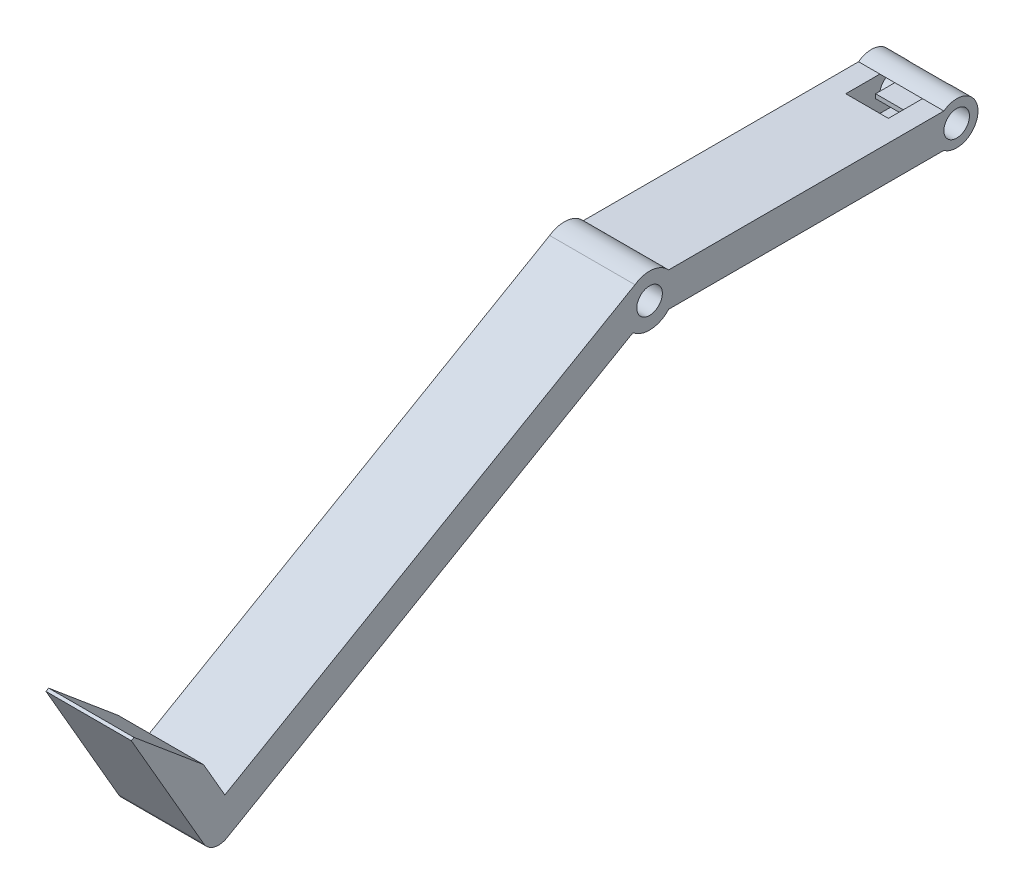
from build123d import *

# Parameters (mm, degrees)
SKETCH1_W           = 10
SKETCH1_H           = 36
BOSS_EXTRUDE2_DEPTH = 4
SKETCH5_R           = 3
BOSS_EXTRUDE3_DEPTH = 10
SKETCH6_R           = 2.5
BOSS_EXTRUDE4_DEPTH = 10
SKETCH9_R           = 1.5
CUT_EXTRUDE2_DEPTH  = 10
SKETCH10_W          = 5
SKETCH10_H          = 8
CUT_EXTRUDE3_DEPTH  = 4
SKETCH11_W          = 4
SKETCH11_H          = 0.5
BOSS_EXTRUDE6_DEPTH = 5
BOSS_EXTRUDE7_DEPTH = 10
SKETCH7_R           = 1.5
CUT_EXTRUDE4_DEPTH  = 10
SKETCH14_W          = 10
SKETCH14_H          = 4
BOSS_EXTRUDE8_DEPTH = 15
FILLET2_R           = 2
CHAMFER1_SIZE       = 10
CHAMFER1_SIZE2      = 3.639702343


with BuildPart() as part:
    # Sketch1 → Boss-Extrude2 (new body)
    with BuildSketch(Plane(origin=(0, 0, 0), x_dir=(1, 0, 0), z_dir=(0, 1, 0))):
        Rectangle(SKETCH1_W, SKETCH1_H)
    extrude(amount=BOSS_EXTRUDE2_DEPTH)

    # Sketch5 → Boss-Extrude3 (add)
    with BuildSketch(Plane(origin=(5, 0, 0), x_dir=(0, 0, -1), z_dir=(1, 0, 0))):
        with Locations((-18, 2)):
            Circle(SKETCH5_R)
    extrude(amount=-BOSS_EXTRUDE3_DEPTH)

    # Sketch6 → Boss-Extrude4 (add)
    with BuildSketch(Plane(origin=(5, 0, 0), x_dir=(0, 0, -1), z_dir=(1, 0, 0))):
        with Locations((18, 2)):
            Circle(SKETCH6_R)
    extrude(amount=-BOSS_EXTRUDE4_DEPTH)

    # Sketch9 → Cut-Extrude2 (cut)
    with BuildSketch(Plane(origin=(5, 0, 0), x_dir=(0, 0, -1), z_dir=(1, 0, 0))):
        with Locations((18, 2)):
            Circle(SKETCH9_R)
    extrude(amount=-CUT_EXTRUDE2_DEPTH, mode=Mode.SUBTRACT)

    # Sketch10 → Cut-Extrude3 (cut)
    with BuildSketch(Plane(origin=(0, 4, 0), x_dir=(1, 0, 0), z_dir=(0, 1, 0))):
        with Locations((0, 16.5)):
            Rectangle(SKETCH10_W, SKETCH10_H)
    extrude(amount=-CUT_EXTRUDE3_DEPTH, mode=Mode.SUBTRACT)

    # Sketch11 → Boss-Extrude6 (add)
    with BuildSketch(Plane.ZY.offset(-2.5)):
        with Locations((-18, 2)):
            Rectangle(SKETCH11_W, SKETCH11_H)
    extrude(amount=BOSS_EXTRUDE6_DEPTH)

    # Sketch13 → Boss-Extrude7 (add)
    with BuildSketch(Plane(origin=(5, 0, 0), x_dir=(0, 0, -1), z_dir=(1, 0, 0))):
        Polygon((-19.282983434, 4.711817381), (-71.244507661, -25.288182619), (-69.244507661, -28.752284234), (-17.282983434, 1.247715766), align=None)
    extrude(amount=-BOSS_EXTRUDE7_DEPTH)

    # Sketch7 → Cut-Extrude4 (cut)
    with BuildSketch(Plane(origin=(5, 0, 0), x_dir=(0, 0, -1), z_dir=(1, 0, 0))):
        with Locations((-18, 2)):
            Circle(SKETCH7_R)
    extrude(amount=-CUT_EXTRUDE4_DEPTH, mode=Mode.SUBTRACT)

    # Sketch14 → Boss-Extrude8 (add)
    with BuildSketch(Plane(origin=(0, 11.883639793, 6.861022633), x_dir=(1, 0, 0), z_dir=(0, 0.8660254037844415, 0.49999999999999506))):
        with Locations((0, -72.343644824)):
            Rectangle(SKETCH14_W, SKETCH14_H)
    extrude(amount=BOSS_EXTRUDE8_DEPTH)

    # Fillet2
    fillet2_edges = [part.edges().sort_by_distance(p)[0] for p in [
        (0, -28.752284234, 69.244507661),
    ]]
    fillet(fillet2_edges, radius=FILLET2_R)

    # Chamfer1
    chamfer1_edges = [part.edges().sort_by_distance(p)[0] for p in [
        (0, -10.297801562, 75.280406046),
    ]]
    chamfer1_side = [part.faces().sort_by_distance(p)[0] for p in [
        (0, -16.792992091, 71.530406046),
    ]]
    chamfer(chamfer1_edges, length=CHAMFER1_SIZE, length2=CHAMFER1_SIZE2, reference=chamfer1_side[0])


solid = part.part
